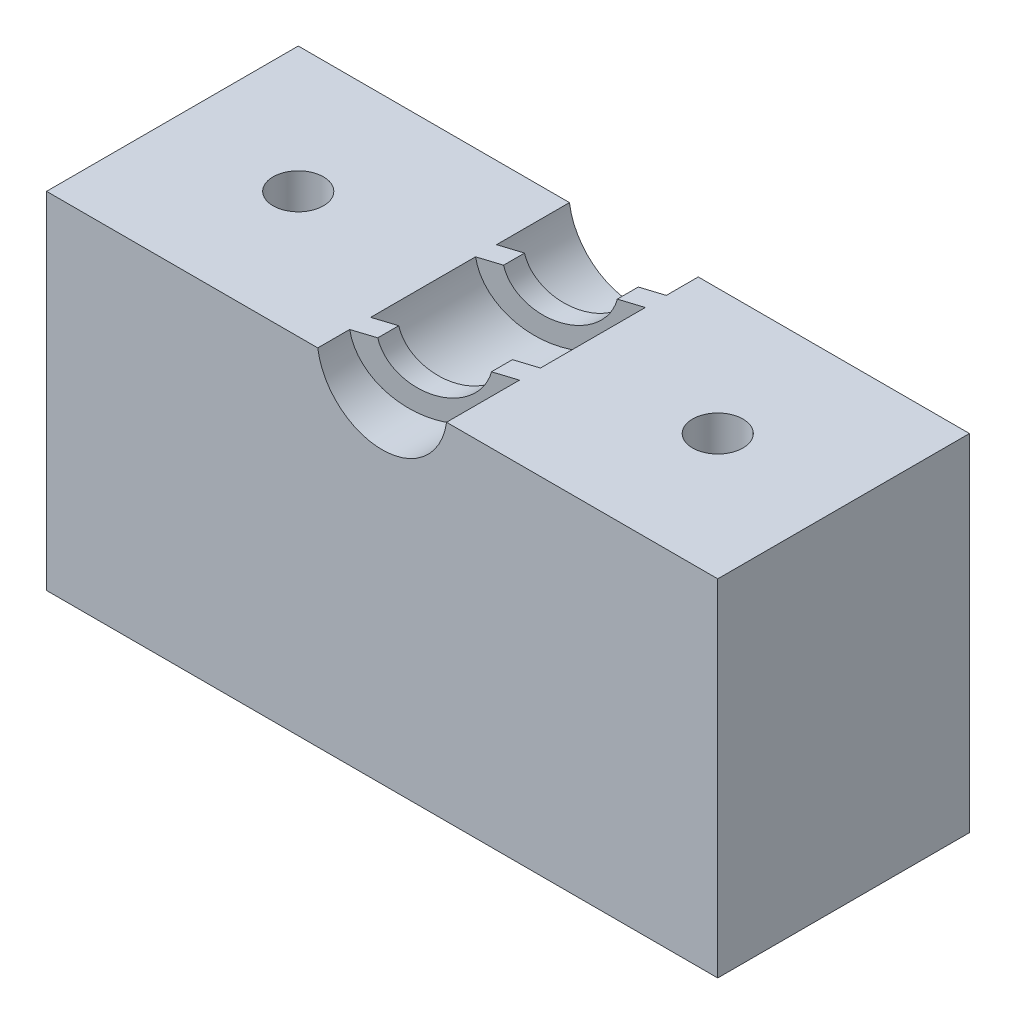
from build123d import *

# Parameters (mm, degrees)
SKETCH_1_W               = 16
SKETCH_1_H               = 16
SKETCH_1_R               = 1.55
EXTRUDE_1_DEPTH          = 3
EXTRUDE_2_DEPTH          = 8
CUT_EXTRUDE_2_DEPTH      = 12.704699911
CUT_EXTRUDE_2_DEPTH_BACK = 12.704699911
SKETCH_8_R               = 0.6
CUT_EXTRUDE_3_DEPTH      = 12.704699911
SKETCH_9_W               = 16
SKETCH_9_H               = 6
SKETCH_9_R               = 0.6
EXTRUDE_3_DEPTH          = 0.455


with BuildPart() as part:
    # 草图1 → 凸台-拉伸1 (new, symmetric)
    with BuildSketch(Plane.XY):
        Rectangle(SKETCH_1_W, SKETCH_1_H)
        Circle(SKETCH_1_R, mode=Mode.SUBTRACT)
    extrude(amount=EXTRUDE_1_DEPTH, both=True)

    # 草图6 → 凸台-拉伸2 (add)
    with BuildSketch(Plane(origin=(0, 0, 0), x_dir=(1, 0, 0), z_dir=(0, 1, 0))):
        Polygon((-1.55, -1.743476048), (-1.55, -2.243476048), (1.55, -1.256523952), (1.55, -0.756523952), align=None)
        Polygon((-1.55, 1.256523952), (-1.55, 0.756523952), (1.55, 1.743476048), (1.55, 2.243476048), align=None)
    extrude(amount=-EXTRUDE_2_DEPTH)

    # 草图7 → 切除-拉伸2 (cut, two sides: drawn at the far end of the back side and taken through both)
    with BuildSketch(Plane.XY.offset(-CUT_EXTRUDE_2_DEPTH_BACK)):
        with BuildLine():
            Line((-8, -0.214092961), (-1.027941732, -0.214092961))
            ThreePointArc((-1.027941732, -0.214092961), (-0.107613153, 1.044470875), (1.05, 0))
            ThreePointArc((1.05, 0), (1.044470875, -0.107613153), (1.027941732, -0.214092961))
            Line((1.027941732, -0.214092961), (8, -0.214092961))
            Line((8, -0.214092961), (8, 8))
            Line((8, 8), (-8, 8))
            Line((-8, 8), (-8, -0.214092961))
        make_face()
        with BuildLine():
            Line((1.027941732, -0.214092961), (0, 0))
            Line((0, 0), (-1.027941732, -0.214092961))
            ThreePointArc((-1.027941732, -0.214092961), (0, -1.05), (1.027941732, -0.214092961))
        make_face()
        with BuildLine():
            Line((-1.027941732, -0.214092961), (0, 0))
            Line((0, 0), (1.027941732, -0.214092961))
            ThreePointArc((1.027941732, -0.214092961), (1.044470875, -0.107613153), (1.05, 0))
            ThreePointArc((1.05, 0), (-0.107613153, 1.044470875), (-1.027941732, -0.214092961))
        make_face()
    extrude(amount=CUT_EXTRUDE_2_DEPTH + CUT_EXTRUDE_2_DEPTH_BACK, mode=Mode.SUBTRACT)

    # 草图8 → 切除-拉伸3 (cut, through all)
    with BuildSketch(Plane(origin=(0, 0, 0), x_dir=(1, 0, 0), z_dir=(0, 1, 0))):
        with Locations(Location((-5, 0, 0), (0, 0, 270))):
            Circle(SKETCH_8_R)
        with Locations(Location((5, 0, 0), (0, 0, 270))):
            Circle(SKETCH_8_R)
    extrude(amount=-CUT_EXTRUDE_3_DEPTH, mode=Mode.SUBTRACT)

    # 草图9 → 凸台-拉伸3 (add)
    with BuildSketch(Plane.XZ.offset(8)):
        Rectangle(SKETCH_9_W, SKETCH_9_H)
        with Locations(Location((-5, 0, 0), (0, 0, 180))):
            Circle(SKETCH_9_R, mode=Mode.SUBTRACT)
        with Locations((5, 0)):
            Circle(SKETCH_9_R, mode=Mode.SUBTRACT)
    extrude(amount=EXTRUDE_3_DEPTH)


solid = part.part
